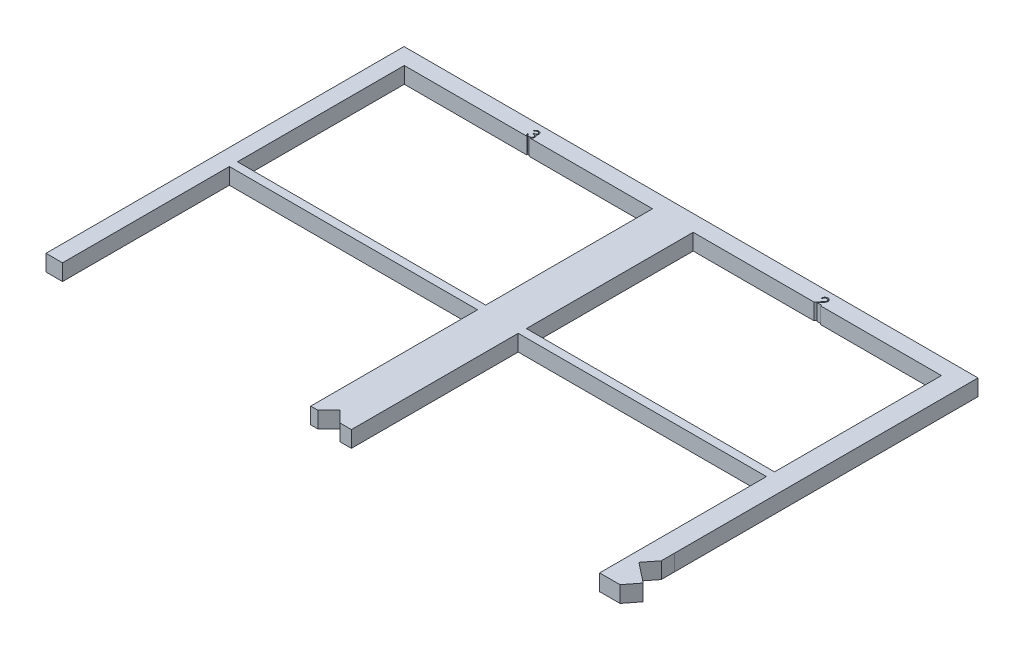
from build123d import *

# Parameters (mm, degrees)
SKETCH1_W           = 77.47
SKETCH1_H           = 52.07
BOSS_EXTRUDE4_DEPTH = 5.08
CUT_EXTRUDE9_DEPTH  = 5.08
CUT_EXTRUDE10_DEPTH = 5.08


with BuildPart() as part:
    # Sketch1 → Boss-Extrude4 (new body)
    with BuildSketch(Plane(origin=(0, 0, 0), x_dir=(1, 0, 0), z_dir=(0, 1, 0))):
        Polygon((-151.207591036, -110.49), (-146.05, -110.49), (-146.05, -58.42), (-68.58, -58.42), (-68.58, -110.49), (-55.88, -110.49), (-55.88, -58.42), (21.59, -58.42), (21.59, -110.49), (34.29, -110.49), (34.29, -58.42), (111.76, -58.42), (111.76, -110.49), (151.052408964, -110.49), (151.052408964, 110.49), (-151.207591036, 110.49), align=None)
        with Locations((-107.315, -29.845)):
            Rectangle(SKETCH1_W, SKETCH1_H, mode=Mode.SUBTRACT)
        with Locations((-17.145, -29.845)):
            Rectangle(SKETCH1_W, SKETCH1_H, mode=Mode.SUBTRACT)
        with Locations((73.025, -29.845)):
            Rectangle(SKETCH1_W, SKETCH1_H, mode=Mode.SUBTRACT)
        with Locations((-107.315, 24.765)):
            Rectangle(SKETCH1_W, SKETCH1_H, mode=Mode.SUBTRACT)
        with Locations((-17.145, 24.765)):
            Rectangle(SKETCH1_W, SKETCH1_H, mode=Mode.SUBTRACT)
        with Locations((-107.315, 79.375)):
            Rectangle(SKETCH1_W, SKETCH1_H, mode=Mode.SUBTRACT)
        with Locations((-17.145, 79.375)):
            Rectangle(SKETCH1_W, SKETCH1_H, mode=Mode.SUBTRACT)
        with Locations((73.025, 24.765)):
            Rectangle(SKETCH1_W, SKETCH1_H, mode=Mode.SUBTRACT)
        with Locations((73.025, 79.375)):
            Rectangle(SKETCH1_W, SKETCH1_H, mode=Mode.SUBTRACT)
    extrude(amount=BOSS_EXTRUDE4_DEPTH)

    # Sketch8 → Cut-Extrude9 (cut)
    # profile 1 of 7: a face of its own
    with BuildSketch(Plane(origin=(0, 5.08, 0), x_dir=(1, 0, 0), z_dir=(0, 1, 0))):
        Polygon((118.11, 79.293589744), (111.76, 76.362820513), (111.76, 76.982301683), (113.79525641, 77.921063702), (113.79525641, 80.799679487), (111.76, 81.765154247), (111.76, 82.387179487), (118.11, 79.375), align=None)
        Polygon((116.872309696, 79.340655048), (114.446538462, 80.49057492), (114.446538462, 78.221264022), align=None, mode=Mode.SUBTRACT)
    # profile 2 of 7: a face of its own
    with BuildSketch(Plane(origin=(0, 5.08, 0), x_dir=(1, 0, 0), z_dir=(0, 1, 0))):
        with BuildLine():
            Line((118.11, 26.474615385), (118.11, 25.235653045))
            add(Edge.make_bspline(
                [(118.11, 25.235653045), (118.109681139, 25.175004234), (118.109063106, 25.057451746), (118.099477996, 24.886510758), (118.086408481, 24.726402202), (118.065671027, 24.577079644), (118.040648803, 24.438612083), (118.010346937, 24.310582227), (117.974012938, 24.193397201), (117.916234684, 24.053492664), (117.830376936, 23.893979465), (117.703506539, 23.721262382), (117.548326213, 23.573571833), (117.37327911, 23.4462338), (117.180718496, 23.344994626), (116.975233967, 23.271753187), (116.75947595, 23.225383899), (116.611351899, 23.220615168), (116.536492388, 23.218205128)],
                knots=[0, 0, 0, 0, 1.001505555, 1.941167018, 2.826882275, 3.653841531, 4.429895133, 5.150066043, 5.825578002, 6.45369114, 7.647487171, 8.808567382, 9.977351308, 11.170798116, 12.373658725, 13.556498008, 14.765093433, 16, 16, 16, 16], degree=3))
            add(Edge.make_bspline(
                [(116.536492388, 23.218205128), (116.466353726, 23.220150205), (116.328524642, 23.223972465), (116.12725909, 23.261767034), (115.934882118, 23.318037757), (115.753765338, 23.399726219), (115.586236491, 23.504802861), (115.433291194, 23.631250472), (115.29863595, 23.781802882), (115.223670167, 23.894781468), (115.185590946, 23.952169471)],
                knots=[0, 0, 0, 0, 1.044266239, 2.052081639, 3.041743201, 4.026043445, 5.00270663, 5.980942822, 6.97441044, 8, 8, 8, 8], degree=3))
            add(Edge.make_bspline(
                [(115.185590946, 23.952169471), (115.157917248, 23.880020614), (115.10497061, 23.741981978), (115.010852235, 23.551885993), (114.90963819, 23.387448746), (114.798522364, 23.248489243), (114.677253559, 23.131437365), (114.548260115, 23.026322349), (114.405191505, 22.938259533), (114.252121508, 22.862606152), (114.090124446, 22.803067733), (113.919941192, 22.760940396), (113.743474705, 22.735055197), (113.623194862, 22.731525492), (113.562473958, 22.72974359)],
                knots=[0, 0, 0, 0, 1.272302504, 2.434229863, 3.488457646, 4.447234501, 5.35599188, 6.26022912, 7.18267843, 8.11661068, 9.06895546, 10.019249207, 11.000057067, 12, 12, 12, 12], degree=3))
            add(Edge.make_bspline(
                [(113.562473958, 22.72974359), (113.500485842, 22.731516424), (113.378522486, 22.735004524), (113.199347436, 22.7607231), (113.028142769, 22.804311677), (112.863691196, 22.864204763), (112.70692357, 22.942816916), (112.555876508, 23.036423505), (112.414573802, 23.150354586), (112.279655118, 23.277346904), (112.158418428, 23.421179366), (112.05048411, 23.576340817), (111.961311987, 23.745062992), (111.887341532, 23.924729456), (111.830014808, 24.116534097), (111.790215937, 24.31976575), (111.763336967, 24.53446858), (111.761131196, 24.681807332), (111.76, 24.757367788)],
                knots=[0, 0, 0, 0, 0.978404568, 1.925038397, 2.85041836, 3.763147166, 4.682162379, 5.614488577, 6.562659439, 7.54271123, 8.535210642, 9.526693784, 10.520907202, 11.541451354, 12.589717429, 13.675358278, 14.807842563, 16, 16, 16, 16], degree=3))
            Line((111.76, 24.757367788), (111.76, 26.474615385))
            Line((111.76, 26.474615385), (118.11, 26.474615385))
        make_face()
        with BuildLine():
            Line((117.458717949, 25.90474359), (115.423461538, 25.90474359))
            Line((115.423461538, 25.90474359), (115.423461538, 25.521860978))
            add(Edge.make_bspline(
                [(115.423461538, 25.521860978), (115.424181075, 25.465891945), (115.425571367, 25.357748368), (115.429679415, 25.200723225), (115.440678409, 25.055331233), (115.452311659, 24.921071395), (115.470224485, 24.798843581), (115.49214475, 24.688238604), (115.515124768, 24.588262886), (115.554315522, 24.473021329), (115.611648095, 24.342338932), (115.702715767, 24.203911992), (115.808237502, 24.079896012), (115.932241327, 23.976344233), (116.067626032, 23.890895914), (116.214403686, 23.833871415), (116.366844139, 23.793424687), (116.471770578, 23.789877771), (116.525044071, 23.788076923)],
                knots=[0, 0, 0, 0, 1.156481963, 2.23455883, 3.244418989, 4.168404366, 5.01828131, 5.794834307, 6.498111525, 7.13526334, 8.307595709, 9.435046769, 10.546766856, 11.659452936, 12.760769924, 13.837671619, 14.902137667, 16, 16, 16, 16], degree=3))
            add(Edge.make_bspline(
                [(116.525044071, 23.788076923), (116.56030457, 23.788977603), (116.629471889, 23.790744385), (116.729913527, 23.8068242), (116.82558773, 23.830156168), (116.914294057, 23.866607821), (116.998553798, 23.910685404), (117.074624411, 23.96802234), (117.1466735, 24.032775181), (117.212055599, 24.108821091), (117.270638216, 24.195791849), (117.322185781, 24.294516129), (117.362847974, 24.406172748), (117.399324126, 24.528230019), (117.4246346, 24.66264136), (117.445797527, 24.808093389), (117.456555228, 24.965820019), (117.457980962, 25.074940101), (117.458717949, 25.131346154)],
                knots=[0, 0, 0, 0, 0.911752476, 1.788502045, 2.626783689, 3.45400582, 4.26402138, 5.080402872, 5.911472738, 6.767166405, 7.66795952, 8.620018292, 9.640966946, 10.73819047, 11.913090943, 13.176185384, 14.540321519, 16, 16, 16, 16], degree=3))
            Line((117.458717949, 25.131346154), (117.458717949, 25.90474359))
        make_face(mode=Mode.SUBTRACT)
        with BuildLine():
            Line((114.772179487, 25.90474359), (112.411282051, 25.90474359))
            Line((112.411282051, 25.90474359), (112.411282051, 25.093185096))
            add(Edge.make_bspline(
                [(112.411282051, 25.093185096), (112.411975847, 25.035093328), (112.413313047, 24.923129104), (112.417726104, 24.761477849), (112.427553327, 24.612056238), (112.443574322, 24.47477829), (112.460221531, 24.348435585), (112.483262073, 24.23428334), (112.509456384, 24.132146551), (112.549993321, 24.013731405), (112.612860676, 23.880302727), (112.708268617, 23.736613475), (112.820435778, 23.607586425), (112.95189156, 23.499274679), (113.093745082, 23.409835086), (113.245254404, 23.347105881), (113.401797428, 23.306771901), (113.508807295, 23.302005692), (113.562473958, 23.299615385)],
                knots=[0, 0, 0, 0, 1.159821618, 2.235403267, 3.228114831, 4.14795534, 4.994323282, 5.771256229, 6.471395042, 7.097801288, 8.267864287, 9.404187171, 10.531774336, 11.667624178, 12.792825787, 13.866573821, 14.930062559, 16, 16, 16, 16], degree=3))
            add(Edge.make_bspline(
                [(113.562473958, 23.299615385), (113.596030503, 23.300103956), (113.662602321, 23.301073218), (113.760357737, 23.31624054), (113.855472736, 23.337399943), (113.946509043, 23.368040578), (114.034948011, 23.406675936), (114.119249173, 23.455161844), (114.2014282, 23.511153881), (114.305201688, 23.598743929), (114.42480707, 23.726024945), (114.541892162, 23.906931894), (114.636322991, 24.112618706), (114.676417579, 24.261803289), (114.697129407, 24.338868189)],
                knots=[0, 0, 0, 0, 0.723503378, 1.435336582, 2.130201219, 2.824764462, 3.504949994, 4.209866579, 4.920640069, 5.648298893, 7.13757748, 8.670694625, 10.280166878, 12, 12, 12, 12], degree=3))
            add(Edge.make_bspline(
                [(114.697129407, 24.338868189), (114.703398338, 24.369763806), (114.716990673, 24.436751875), (114.731329404, 24.545986183), (114.744191712, 24.671110852), (114.753456167, 24.811591078), (114.763401398, 24.967985569), (114.767131466, 25.140244081), (114.771684212, 25.328488394), (114.772010172, 25.459103286), (114.772179487, 25.526949119)],
                knots=[0, 0, 0, 0, 0.634452549, 1.375623993, 2.216454381, 3.166361212, 4.209414599, 5.370755378, 6.634280627, 8, 8, 8, 8], degree=3))
            Line((114.772179487, 25.526949119), (114.772179487, 25.90474359))
        make_face(mode=Mode.SUBTRACT)
    # profile 3 of 7: a face of its own
    with BuildSketch(Plane(origin=(0, 5.08, 0), x_dir=(1, 0, 0), z_dir=(0, 1, 0))):
        with BuildLine():
            Line((116.944815705, -32.938589744), (116.563205128, -32.439951923))
            add(Edge.make_bspline(
                [(116.563205128, -32.439951923), (116.605597673, -32.40438124), (116.689811221, -32.333719444), (116.808065537, -32.220037748), (116.918855368, -32.10156191), (117.022708493, -31.978337218), (117.115993196, -31.848145673), (117.203570769, -31.714141081), (117.282070808, -31.574081771), (117.377253654, -31.380403623), (117.476578821, -31.127042527), (117.559860398, -30.808100462), (117.612875959, -30.475158898), (117.618617886, -30.248014681), (117.621538462, -30.132479968)],
                knots=[0, 0, 0, 0, 0.757959112, 1.505699292, 2.245454638, 2.979532153, 3.711538275, 4.438200793, 5.171680507, 5.909471876, 7.393775596, 8.890124382, 10.418191784, 12, 12, 12, 12], degree=3))
            add(Edge.make_bspline(
                [(117.621538462, -30.132479968), (117.620802251, -30.068829613), (117.619336663, -29.942119638), (117.600137483, -29.754060275), (117.572842033, -29.56915638), (117.533326202, -29.388095544), (117.481880175, -29.211237272), (117.421547717, -29.037234935), (117.346470096, -28.868137816), (117.263556886, -28.701910874), (117.169880198, -28.542661658), (117.067735433, -28.391952614), (116.958125128, -28.250472259), (116.84133222, -28.117828549), (116.715905207, -27.995476207), (116.58331959, -27.881454356), (116.441979536, -27.777817938), (116.294535759, -27.682020268), (116.140771545, -27.596777475), (115.9816542, -27.523166197), (115.817792087, -27.46007521), (115.648849522, -27.409690045), (115.475491338, -27.369948117), (115.297349628, -27.342492588), (115.114770175, -27.323466123), (114.991019157, -27.322014016), (114.928639824, -27.321282051)],
                knots=[0, 0, 0, 0, 1.055000685, 2.100209969, 3.131349012, 4.153242145, 5.170189196, 6.184191144, 7.204341339, 8.235672124, 9.263040994, 10.265373269, 11.252624173, 12.22887325, 13.193405896, 14.155809299, 15.126090485, 16.097288279, 17.069732292, 18.038585918, 19.002221264, 19.978698174, 20.959418239, 21.948869816, 22.966084182, 24, 24, 24, 24], degree=3))
            add(Edge.make_bspline(
                [(114.928639824, -27.321282051), (114.834784429, -27.323571352), (114.650511811, -27.328066089), (114.380599417, -27.368068066), (114.122026195, -27.428855875), (113.876408481, -27.519961279), (113.640717603, -27.632300128), (113.418941397, -27.774250951), (113.207728487, -27.938655241), (113.012070568, -28.12783883), (112.833338524, -28.335403668), (112.675948183, -28.55810345), (112.544748325, -28.795383515), (112.435571964, -29.044623973), (112.351649044, -29.307742779), (112.29256842, -29.584266778), (112.254029036, -29.873594541), (112.250339344, -30.071296166), (112.248461538, -30.171913061)],
                knots=[0, 0, 0, 0, 1.029171465, 2.020641659, 2.987623507, 3.938342917, 4.889210282, 5.84687017, 6.821220943, 7.821438502, 8.827599549, 9.822697543, 10.807740252, 11.797342354, 12.80366471, 13.83203677, 14.896651826, 16, 16, 16, 16], degree=3))
            add(Edge.make_bspline(
                [(112.248461538, -30.171913061), (112.251525467, -30.282770797), (112.257556013, -30.50096534), (112.308644936, -30.820947331), (112.391481444, -31.127263648), (112.507410532, -31.41993077), (112.658114697, -31.698123628), (112.840809417, -31.962277569), (113.057232535, -32.212615561), (113.222483354, -32.363149173), (113.306794872, -32.439951923)],
                knots=[0, 0, 0, 0, 1.028121516, 2.023589091, 2.998037872, 3.967518031, 4.937445131, 5.927275754, 6.942489185, 8, 8, 8, 8], degree=3))
            Line((113.306794872, -32.439951923), (112.929000401, -32.938589744))
            add(Edge.make_bspline(
                [(112.929000401, -32.938589744), (112.877223407, -32.898461226), (112.773917427, -32.818396404), (112.628282924, -32.688750355), (112.491292127, -32.552178781), (112.36407883, -32.407649584), (112.243987323, -32.256891333), (112.135043577, -32.097248498), (112.033928993, -31.93147842), (111.942568033, -31.758615962), (111.860652906, -31.579228654), (111.791497891, -31.393503181), (111.731069307, -31.20301302), (111.681684053, -31.007662239), (111.643076564, -30.806798224), (111.617282312, -30.601110145), (111.599606535, -30.390163816), (111.597995761, -30.247848605), (111.597179487, -30.175729167)],
                knots=[0, 0, 0, 0, 0.986756325, 1.968786143, 2.935506311, 3.899499537, 4.868307269, 5.8376204, 6.809456583, 7.792545619, 8.781780509, 9.778496008, 10.776623214, 11.79151764, 12.812666265, 13.856269958, 14.913646641, 16, 16, 16, 16], degree=3))
            add(Edge.make_bspline(
                [(111.597179487, -30.175729167), (111.597654817, -30.107432799), (111.598594721, -29.97238519), (111.613820511, -29.772997455), (111.634593605, -29.578887787), (111.665872129, -29.390610966), (111.702782574, -29.207139554), (111.752260425, -29.030136779), (111.807685342, -28.857860898), (111.872827246, -28.691004051), (111.946335178, -28.52942431), (112.029414149, -28.373642823), (112.121365532, -28.223731239), (112.220162479, -28.07821569), (112.328978441, -27.939245788), (112.446302192, -27.805617249), (112.571738298, -27.676580756), (112.662189246, -27.596747314), (112.707666266, -27.556608574)],
                knots=[0, 0, 0, 0, 1.114604814, 2.203992996, 3.262667896, 4.300477797, 5.318619304, 6.316056647, 7.298880507, 8.271930387, 9.238335007, 10.195173496, 11.151986948, 12.108099108, 13.064862484, 14.031167946, 15.010108607, 16, 16, 16, 16], degree=3))
            add(Edge.make_bspline(
                [(112.707666266, -27.556608574), (112.786662423, -27.492318192), (112.943701026, -27.364513598), (113.198219878, -27.200999858), (113.463955057, -27.061032151), (113.742302642, -26.947864409), (114.032638045, -26.859394879), (114.335107621, -26.798106139), (114.649428887, -26.758279657), (114.86321849, -26.753725276), (114.971889022, -26.751410256)],
                knots=[0, 0, 0, 0, 0.994628077, 1.977248131, 2.950237994, 3.925870899, 4.908910175, 5.911660606, 6.938484602, 8, 8, 8, 8], degree=3))
            add(Edge.make_bspline(
                [(114.971889022, -26.751410256), (115.086103424, -26.754244442), (115.310813128, -26.759820525), (115.640671219, -26.806804203), (115.956243845, -26.883302707), (116.258745252, -26.988641657), (116.546444643, -27.127611896), (116.820557094, -27.295846609), (117.080858784, -27.494989044), (117.324021732, -27.72253816), (117.546337205, -27.97213776), (117.741930009, -28.239412742), (117.904702809, -28.523860895), (118.040767384, -28.82234304), (118.145350881, -29.137095699), (118.218563099, -29.467446937), (118.264132722, -29.812776116), (118.269893457, -30.048383659), (118.272820513, -30.168096955)],
                knots=[0, 0, 0, 0, 1.032901378, 2.032168977, 3.007206631, 3.966850309, 4.924221947, 5.891988639, 6.871730993, 7.884084801, 8.900290346, 9.89161143, 10.874607481, 11.860025555, 12.854717796, 13.869097222, 14.917278314, 16, 16, 16, 16], degree=3))
            add(Edge.make_bspline(
                [(118.272820513, -30.168096955), (118.27194643, -30.24105764), (118.270216271, -30.385475968), (118.253322795, -30.599110851), (118.225211517, -30.807112405), (118.186697164, -31.009983654), (118.139491479, -31.208460249), (118.077695589, -31.40050597), (118.005935411, -31.587166578), (117.925394904, -31.768581871), (117.833318651, -31.942778105), (117.733314188, -32.109723579), (117.623073079, -32.267404402), (117.506239897, -32.418786561), (117.378444314, -32.560461963), (117.243848093, -32.696476823), (117.098457292, -32.822132675), (116.996123317, -32.89969966), (116.944815705, -32.938589744)],
                knots=[0, 0, 0, 0, 1.096705196, 2.170817488, 3.219277236, 4.250701065, 5.274195539, 6.284202015, 7.28098643, 8.279664616, 9.266225751, 10.241373748, 11.203306326, 12.157093976, 13.114198862, 14.069774147, 15.032234603, 16, 16, 16, 16], degree=3))
        make_face()
    # profile 4 of 7: a face of its own
    with BuildSketch(Plane(origin=(0, 5.08, 0), x_dir=(1, 0, 0), z_dir=(0, 1, 0))):
        with BuildLine():
            Line((111.76, -82.012692308), (118.11, -82.012692308))
            Line((118.11, -82.012692308), (118.11, -83.294903846))
            add(Edge.make_bspline(
                [(118.11, -83.294903846), (118.10919924, -83.406426385), (118.107652175, -83.62188735), (118.097786915, -83.933238257), (118.080511466, -84.220906485), (118.054862343, -84.484728674), (118.024076207, -84.725128674), (117.984923928, -84.941721457), (117.938878197, -85.134858028), (117.899605318, -85.253638066), (117.881033654, -85.309807692)],
                knots=[0, 0, 0, 0, 1.314317071, 2.539253741, 3.67075822, 4.709970291, 5.662644612, 6.526156501, 7.303037452, 8, 8, 8, 8], degree=3))
            add(Edge.make_bspline(
                [(117.881033654, -85.309807692), (117.853037914, -85.383276673), (117.797681284, -85.528548601), (117.693258165, -85.735390771), (117.574941266, -85.930107124), (117.44258475, -86.11375686), (117.2924032, -86.282089414), (117.130916153, -86.441891296), (116.951524797, -86.585988874), (116.760320009, -86.720164865), (116.555362101, -86.837571052), (116.340810785, -86.941109671), (116.117067511, -87.029513574), (115.882503759, -87.098492965), (115.639371325, -87.15548169), (115.385829701, -87.193719768), (115.123356971, -87.219119775), (114.945238152, -87.221659883), (114.854861779, -87.222948718)],
                knots=[0, 0, 0, 0, 0.98467389, 1.947018643, 2.898343565, 3.837828625, 4.779009928, 5.722093987, 6.681368302, 7.658573986, 8.646467994, 9.637429229, 10.641859304, 11.657149908, 12.698561448, 13.768651538, 14.867827761, 16, 16, 16, 16], degree=3))
            add(Edge.make_bspline(
                [(114.854861779, -87.222948718), (114.776373797, -87.221806822), (114.621705032, -87.219556598), (114.39375275, -87.199375846), (114.172580583, -87.169987158), (113.959159893, -87.124695693), (113.752052982, -87.069043404), (113.552243376, -87.000351318), (113.359584615, -86.918944546), (113.175646042, -86.82449634), (113.000731948, -86.721221421), (112.837852299, -86.607986514), (112.683909336, -86.491289421), (112.545846691, -86.362132049), (112.415768103, -86.229414775), (112.300701958, -86.08609986), (112.195636064, -85.936856417), (112.101337325, -85.778809783), (112.019522725, -85.608171823), (111.94943361, -85.422613554), (111.891722261, -85.221141181), (111.843495333, -85.004063511), (111.805260876, -84.770955192), (111.779629867, -84.521602395), (111.762298604, -84.256383924), (111.760781079, -84.074267288), (111.76, -83.980530849)],
                knots=[0, 0, 0, 0, 1.105818345, 2.179130549, 3.222742436, 4.24813173, 5.251184997, 6.243232575, 7.223185975, 8.195898781, 9.155064964, 10.083206407, 10.990357329, 11.874224667, 12.744762365, 13.607037788, 14.46074101, 15.315384698, 16.197310979, 17.123950979, 18.107232398, 19.148086642, 20.256146639, 21.433991621, 22.679261309, 24, 24, 24, 24], degree=3))
            Line((111.76, -83.980530849), (111.76, -82.012692308))
        make_face()
        with BuildLine():
            Line((112.411282051, -82.582564103), (112.411282051, -83.311440304))
            add(Edge.make_bspline(
                [(112.411282051, -83.311440304), (112.411732169, -83.416176063), (112.41259791, -83.617621283), (112.420194693, -83.907286506), (112.432607922, -84.171953411), (112.449979849, -84.411659579), (112.472964337, -84.626269665), (112.498590946, -84.816232183), (112.53051775, -84.980924438), (112.559457347, -85.08058213), (112.572830529, -85.126634615)],
                knots=[0, 0, 0, 0, 1.375205317, 2.645023457, 3.804390687, 4.853969522, 5.800190428, 6.637939096, 7.370582563, 8, 8, 8, 8], degree=3))
            add(Edge.make_bspline(
                [(112.572830529, -85.126634615), (112.593242549, -85.184599298), (112.633579048, -85.299144178), (112.707184232, -85.464010709), (112.794265109, -85.61784952), (112.891632722, -85.763227177), (113.000795015, -85.899202305), (113.122082386, -86.02517169), (113.254153497, -86.142030641), (113.397503093, -86.248500834), (113.551204387, -86.34363756), (113.713300631, -86.426559757), (113.883400607, -86.496918019), (114.062117399, -86.554129451), (114.249282549, -86.598465023), (114.444403664, -86.63000926), (114.647541614, -86.649619319), (114.785702691, -86.651909464), (114.856133814, -86.653076923)],
                knots=[0, 0, 0, 0, 0.998463025, 1.973077781, 2.929496817, 3.867873318, 4.813809365, 5.759268434, 6.706333209, 7.676553387, 8.657505312, 9.640584699, 10.632319813, 11.645628493, 12.686877747, 13.755137172, 14.855624085, 16, 16, 16, 16], degree=3))
            add(Edge.make_bspline(
                [(114.856133814, -86.653076923), (114.930398398, -86.652144681), (115.07629183, -86.650313282), (115.290366967, -86.627332533), (115.49623045, -86.593678155), (115.694030492, -86.545268959), (115.88350975, -86.482728451), (116.065738702, -86.407893664), (116.238372234, -86.317032486), (116.402872487, -86.214168026), (116.556748208, -86.098683831), (116.698196661, -85.971092184), (116.827481331, -85.832738462), (116.94480806, -85.684260293), (117.048090353, -85.523581703), (117.139968669, -85.353421689), (117.218033951, -85.17138332), (117.259539698, -85.044720759), (117.280633013, -84.980350561)],
                knots=[0, 0, 0, 0, 1.122272916, 2.204715076, 3.251197285, 4.274229216, 5.279697671, 6.265416158, 7.248880903, 8.225321784, 9.195852973, 10.153576302, 11.101466393, 12.055578741, 13.010401466, 13.985536859, 14.976245305, 16, 16, 16, 16], degree=3))
            add(Edge.make_bspline(
                [(117.280633013, -84.980350561), (117.295358532, -84.927099195), (117.326669026, -84.813872182), (117.36082363, -84.629106297), (117.390948936, -84.421161669), (117.416454236, -84.189115068), (117.434755519, -83.933231006), (117.448492047, -83.653312687), (117.457756937, -83.349239119), (117.458389591, -83.138450807), (117.458717949, -83.029048478)],
                knots=[0, 0, 0, 0, 0.674548936, 1.434276114, 2.292660221, 3.240891867, 4.284742987, 5.42552168, 6.663806718, 8, 8, 8, 8], degree=3))
            Line((117.458717949, -83.029048478), (117.458717949, -82.582564103))
            Line((117.458717949, -82.582564103), (112.411282051, -82.582564103))
        make_face(mode=Mode.SUBTRACT)
    # profile 5 of 7: a face of its own
    with BuildSketch(Plane(origin=(0, 5.08, 0), x_dir=(1, 0, 0), z_dir=(0, 1, 0))):
        with BuildLine():
            Line((-108.006987179, 107.852307692), (-108.291923077, 107.852307692))
            add(Edge.make_bspline(
                [(-108.291923077, 107.852307692), (-108.284203699, 107.884268588), (-108.269112946, 107.946749526), (-108.23763729, 108.03601897), (-108.203347966, 108.120495307), (-108.162173564, 108.198596746), (-108.117262051, 108.271892893), (-108.065806439, 108.338721313), (-108.010180691, 108.400781646), (-107.948653773, 108.455857226), (-107.884129915, 108.50572988), (-107.815699939, 108.548252254), (-107.7447406, 108.584832021), (-107.670760258, 108.614967517), (-107.593538659, 108.637669242), (-107.513773929, 108.654140059), (-107.43125704, 108.664836284), (-107.375243154, 108.66588019), (-107.346800881, 108.666410256)],
                knots=[0, 0, 0, 0, 1.162005537, 2.271625781, 3.343758855, 4.383309926, 5.390229558, 6.379919256, 7.361854164, 8.333198761, 9.295911338, 10.242430842, 11.177959212, 12.116337295, 13.062827104, 14.020064771, 14.994644689, 16, 16, 16, 16], degree=3))
            add(Edge.make_bspline(
                [(-107.346800881, 108.666410256), (-107.305360108, 108.665159098), (-107.223382505, 108.662684071), (-107.102947456, 108.640083118), (-106.986808841, 108.604318891), (-106.876237881, 108.554903438), (-106.773532588, 108.493954947), (-106.682150476, 108.421415507), (-106.603330184, 108.338684712), (-106.53720457, 108.247305886), (-106.485429392, 108.14964696), (-106.447251039, 108.049135389), (-106.424008514, 107.9460096), (-106.420996295, 107.876379783), (-106.419487179, 107.841495393)],
                knots=[0, 0, 0, 0, 1.083050992, 2.142477498, 3.193116406, 4.255571735, 5.30263384, 6.308962982, 7.297363603, 8.282367274, 9.249857812, 10.179914175, 11.08814088, 12, 12, 12, 12], degree=3))
            add(Edge.make_bspline(
                [(-106.419487179, 107.841495393), (-106.420542723, 107.807924943), (-106.422608257, 107.742232783), (-106.44014669, 107.646328282), (-106.469661729, 107.555939116), (-106.510546442, 107.470684776), (-106.563470562, 107.391105814), (-106.627580795, 107.317023185), (-106.703329638, 107.248108306), (-106.760732674, 107.208629927), (-106.790285457, 107.188305288)],
                knots=[0, 0, 0, 0, 1.024540389, 2.004866551, 2.965041327, 3.920577974, 4.882998113, 5.874504559, 6.905732034, 8, 8, 8, 8], degree=3))
            add(Edge.make_bspline(
                [(-106.790285457, 107.188305288), (-106.756510937, 107.171996519), (-106.689593843, 107.139684128), (-106.598380149, 107.076314977), (-106.515578076, 107.003148148), (-106.469401131, 106.94605017), (-106.44619992, 106.917361779)],
                knots=[0, 0, 0, 0, 1.015518401, 2.012035669, 3.001164323, 4, 4, 4, 4], degree=3))
            add(Edge.make_bspline(
                [(-106.44619992, 106.917361779), (-106.430922416, 106.896445104), (-106.400617589, 106.85495428), (-106.363211069, 106.788246236), (-106.329275659, 106.720798814), (-106.302832245, 106.65080421), (-106.282354523, 106.57907369), (-106.267716837, 106.505484088), (-106.258623509, 106.429975311), (-106.257321258, 106.378891847), (-106.256666667, 106.353214143)],
                knots=[0, 0, 0, 0, 1.025084078, 2.033381695, 3.024893161, 4.013698104, 4.991890475, 5.976764909, 6.982997093, 8, 8, 8, 8], degree=3))
            add(Edge.make_bspline(
                [(-106.256666667, 106.353214143), (-106.258294547, 106.308755324), (-106.261542646, 106.220046911), (-106.290574914, 106.088987699), (-106.335581211, 105.960875994), (-106.399495717, 105.838343818), (-106.477389814, 105.723698758), (-106.570061101, 105.621122392), (-106.676456629, 105.532949372), (-106.795116039, 105.459280094), (-106.923673719, 105.400390265), (-107.061174435, 105.359516727), (-107.205636984, 105.332895713), (-107.304703604, 105.330041054), (-107.355069111, 105.328589744)],
                knots=[0, 0, 0, 0, 0.955779014, 1.907060117, 2.875433937, 3.871313158, 4.872415639, 5.851225146, 6.836215519, 7.83643374, 8.849228613, 9.86973379, 10.916971861, 12, 12, 12, 12], degree=3))
            add(Edge.make_bspline(
                [(-107.355069111, 105.328589744), (-107.389013762, 105.329377337), (-107.455805515, 105.330927058), (-107.553997832, 105.341521218), (-107.647725373, 105.36087058), (-107.737114866, 105.386908578), (-107.82224572, 105.419921087), (-107.902858158, 105.46103162), (-107.979448133, 105.509392769), (-108.051292896, 105.565575381), (-108.118383883, 105.628423453), (-108.17893814, 105.699052698), (-108.233965237, 105.776157486), (-108.281991774, 105.860633401), (-108.325205295, 105.951388741), (-108.36074802, 106.049585593), (-108.392031357, 106.154346099), (-108.406576, 106.227350906), (-108.414038462, 106.264807692)],
                knots=[0, 0, 0, 0, 1.048658725, 2.063410685, 3.046034179, 4.001477787, 4.936774919, 5.862367409, 6.792675028, 7.730719943, 8.675894397, 9.627829632, 10.600096036, 11.597688215, 12.626045268, 13.701542398, 14.82072376, 16, 16, 16, 16], degree=3))
            Line((-108.414038462, 106.264807692), (-108.129102564, 106.264807692))
            add(Edge.make_bspline(
                [(-108.129102564, 106.264807692), (-108.12167915, 106.240361087), (-108.107239964, 106.192810317), (-108.082661565, 106.124375183), (-108.054659633, 106.061638949), (-108.024619997, 106.004141403), (-107.993070978, 105.951316295), (-107.957769582, 105.904560456), (-107.921330429, 105.861820237), (-107.89386273, 105.837740482), (-107.880419671, 105.825955529)],
                knots=[0, 0, 0, 0, 1.198163088, 2.33053128, 3.407730985, 4.417276592, 5.372219308, 6.28897303, 7.162600585, 8, 8, 8, 8], degree=3))
            add(Edge.make_bspline(
                [(-107.880419671, 105.825955529), (-107.862642777, 105.812250112), (-107.827143861, 105.784881583), (-107.769296966, 105.749955106), (-107.708459534, 105.71969189), (-107.643313365, 105.696574537), (-107.575264252, 105.677000516), (-107.503212285, 105.664191188), (-107.427793138, 105.655402633), (-107.376296667, 105.654627088), (-107.34998097, 105.654230769)],
                knots=[0, 0, 0, 0, 0.946170439, 1.889420265, 2.845303464, 3.807233317, 4.801018734, 5.828864929, 6.890507805, 8, 8, 8, 8], degree=3))
            add(Edge.make_bspline(
                [(-107.34998097, 105.654230769), (-107.320268864, 105.654789483), (-107.262169405, 105.655882), (-107.177392497, 105.665929249), (-107.096740741, 105.680561838), (-107.021109587, 105.703161472), (-106.949508341, 105.731084102), (-106.882940702, 105.766143727), (-106.820532806, 105.807277867), (-106.763083988, 105.854031247), (-106.711426277, 105.905213603), (-106.665942576, 105.958746889), (-106.627275919, 106.014405392), (-106.596085101, 106.072497116), (-106.571455674, 106.132781502), (-106.55468877, 106.195427726), (-106.54303061, 106.259923103), (-106.542081183, 106.303764382), (-106.541602564, 106.325865385)],
                knots=[0, 0, 0, 0, 1.217147791, 2.380027433, 3.494444702, 4.572153297, 5.609568379, 6.639424714, 7.649109417, 8.668170816, 9.669597737, 10.625200337, 11.543417969, 12.441394052, 13.322311151, 14.205496177, 15.095365482, 16, 16, 16, 16], degree=3))
            add(Edge.make_bspline(
                [(-106.541602564, 106.325865385), (-106.542990766, 106.355448528), (-106.545760263, 106.414467612), (-106.566904474, 106.501297126), (-106.601683301, 106.584956936), (-106.650371936, 106.664019688), (-106.709640776, 106.737294971), (-106.778914656, 106.802674101), (-106.858768834, 106.856621969), (-106.93226543, 106.893895251), (-106.997366679, 106.919328883), (-107.053079206, 106.936269744), (-107.115451268, 106.950614988), (-107.183728599, 106.96396112), (-107.258425659, 106.975319772), (-107.339461128, 106.984791991), (-107.426851426, 106.992371206), (-107.487349841, 106.995755843), (-107.518525641, 106.9975)],
                knots=[0, 0, 0, 0, 1.07054697, 2.135767047, 3.216561865, 4.33974944, 5.486079747, 6.621378074, 7.775625952, 8.963672916, 9.598146892, 10.304877434, 11.070270905, 11.915000392, 12.823868403, 13.805723172, 14.86925407, 16, 16, 16, 16], degree=3))
            Line((-107.518525641, 106.9975), (-107.518525641, 107.323141026))
            add(Edge.make_bspline(
                [(-107.518525641, 107.323141026), (-107.479245298, 107.323807598), (-107.402304755, 107.325113248), (-107.289914921, 107.340904801), (-107.182442702, 107.36274937), (-107.082269872, 107.396209509), (-106.990967111, 107.435071778), (-106.911755757, 107.480294854), (-106.84574556, 107.530563948), (-106.793257302, 107.586654958), (-106.753770073, 107.64681218), (-106.724898621, 107.709510862), (-106.707844039, 107.775300546), (-106.705567413, 107.82019928), (-106.704423077, 107.842767428)],
                knots=[0, 0, 0, 0, 1.321986639, 2.589447074, 3.816329219, 5.01088745, 6.139805852, 7.153945165, 8.075214402, 8.924034688, 9.728124013, 10.488707548, 11.240355623, 12, 12, 12, 12], degree=3))
            add(Edge.make_bspline(
                [(-106.704423077, 107.842767428), (-106.704799007, 107.859347954), (-106.705546902, 107.892334124), (-106.714978718, 107.94052615), (-106.729151955, 107.987244866), (-106.748637138, 108.032291594), (-106.774717676, 108.075353913), (-106.80592882, 108.116798956), (-106.84309274, 108.156390099), (-106.885678967, 108.19329296), (-106.931409676, 108.228462197), (-106.981529114, 108.258319567), (-107.034526101, 108.283851159), (-107.090459309, 108.304905493), (-107.149510255, 108.320743562), (-107.211401489, 108.332115361), (-107.27625103, 108.339225234), (-107.320493959, 108.340248868), (-107.342984776, 108.340769231)],
                knots=[0, 0, 0, 0, 0.884392785, 1.759457502, 2.611959086, 3.489218968, 4.37281399, 5.2945488, 6.255912374, 7.266815255, 8.301784654, 9.332968512, 10.37626691, 11.440494194, 12.520033166, 13.637162961, 14.798855837, 16, 16, 16, 16], degree=3))
            add(Edge.make_bspline(
                [(-107.342984776, 108.340769231), (-107.379135932, 108.339507067), (-107.449747547, 108.337041767), (-107.551542508, 108.315449033), (-107.646175046, 108.280997486), (-107.718509408, 108.239873961), (-107.771924315, 108.199278925), (-107.810094109, 108.163825617), (-107.847577715, 108.124425841), (-107.88190915, 108.078652887), (-107.916629115, 108.029606584), (-107.94823811, 107.974793673), (-107.978953688, 107.915643972), (-107.997461715, 107.873828647), (-108.006987179, 107.852307692)],
                knots=[0, 0, 0, 0, 1.472543308, 2.876219568, 4.221790263, 5.565193594, 6.249813518, 6.953379497, 7.687249741, 8.463570142, 9.283606569, 10.136032583, 11.040678096, 12, 12, 12, 12], degree=3))
        make_face()
    # profile 6 of 7: a face of its own
    with BuildSketch(Plane(origin=(0, 5.08, 0), x_dir=(1, 0, 0), z_dir=(0, 1, 0))):
        with BuildLine():
            Line((-17.836987179, 107.608076923), (-18.121923077, 107.608076923))
            add(Edge.make_bspline(
                [(-18.121923077, 107.608076923), (-18.120066017, 107.645878371), (-18.1164188, 107.720119409), (-18.099338852, 107.828363239), (-18.074899627, 107.931827235), (-18.040345237, 108.029680657), (-17.997431685, 108.122788718), (-17.945969446, 108.210781589), (-17.885015024, 108.293323596), (-17.81588463, 108.369649547), (-17.74080165, 108.4396697), (-17.659788405, 108.500135528), (-17.574657559, 108.551223701), (-17.48566739, 108.593933113), (-17.391813879, 108.625991402), (-17.293948715, 108.649778175), (-17.191641927, 108.664089574), (-17.12193705, 108.665627894), (-17.086486378, 108.666410256)],
                knots=[0, 0, 0, 0, 1.10065271, 2.161652631, 3.183658789, 4.190468796, 5.17591951, 6.163126047, 7.15150782, 8.156236427, 9.156009102, 10.134482811, 11.092018607, 12.041330605, 13.001268258, 13.972401359, 14.968799086, 16, 16, 16, 16], degree=3))
            add(Edge.make_bspline(
                [(-17.086486378, 108.666410256), (-17.051671982, 108.665595228), (-16.983262938, 108.663993726), (-16.883420968, 108.650240507), (-16.788372994, 108.628699863), (-16.698304806, 108.598478021), (-16.613935018, 108.557852148), (-16.534629828, 108.509050095), (-16.459445093, 108.452607819), (-16.391766082, 108.386156146), (-16.329619467, 108.315215411), (-16.276005278, 108.239479956), (-16.230091909, 108.161257675), (-16.191821656, 108.079952092), (-16.163649302, 107.994797659), (-16.142260499, 107.907034125), (-16.13017063, 107.815753047), (-16.128315139, 107.753970671), (-16.127371795, 107.722560096)],
                knots=[0, 0, 0, 0, 1.111607364, 2.184268762, 3.212621178, 4.221274766, 5.211760367, 6.196651075, 7.1921475, 8.207485113, 9.220403448, 10.201281604, 11.166441695, 12.114753415, 13.065576456, 14.026450734, 14.996634279, 16, 16, 16, 16], degree=3))
            add(Edge.make_bspline(
                [(-16.127371795, 107.722560096), (-16.128907826, 107.678338846), (-16.131952934, 107.590672367), (-16.158000975, 107.461844598), (-16.198683167, 107.337027711), (-16.247666484, 107.236573158), (-16.297080773, 107.155625632), (-16.341610154, 107.088979021), (-16.393738947, 107.01721906), (-16.45422587, 106.940586047), (-16.52181969, 106.858479726), (-16.597132653, 106.770949697), (-16.680701811, 106.678900306), (-16.739356308, 106.616030225), (-16.769749599, 106.583452524)],
                knots=[0, 0, 0, 0, 1.184426356, 2.348067706, 3.509069118, 4.696110526, 5.333549288, 6.050745305, 6.844228056, 7.710549037, 8.667450064, 9.695053472, 10.805634456, 12, 12, 12, 12], degree=3))
            Line((-16.769749599, 106.583452524), (-17.564135617, 105.735641026))
            Line((-17.564135617, 105.735641026), (-16.086666667, 105.735641026))
            Line((-16.086666667, 105.735641026), (-16.086666667, 105.41))
            Line((-16.086666667, 105.41), (-18.244038462, 105.41))
            Line((-18.244038462, 105.41), (-17.012708333, 106.72401242))
            add(Edge.make_bspline(
                [(-17.012708333, 106.72401242), (-16.982729179, 106.755307312), (-16.925145359, 106.815418396), (-16.843699735, 106.903178081), (-16.770548653, 106.984593736), (-16.70521859, 107.059511533), (-16.649126767, 107.129027313), (-16.599349814, 107.190889651), (-16.559466742, 107.247816902), (-16.516182061, 107.313803031), (-16.474259378, 107.39436849), (-16.438234598, 107.492824051), (-16.416268271, 107.59417663), (-16.413633171, 107.662667764), (-16.412307692, 107.697119391)],
                knots=[0, 0, 0, 0, 1.329631726, 2.553950428, 3.673215718, 4.687767853, 5.603093632, 6.413772471, 7.123043292, 7.734684054, 8.834405432, 9.900288307, 10.943827018, 12, 12, 12, 12], degree=3))
            add(Edge.make_bspline(
                [(-16.412307692, 107.697119391), (-16.412884401, 107.718783231), (-16.414020984, 107.7614785), (-16.424051896, 107.824076581), (-16.439210712, 107.884460376), (-16.460932482, 107.942815624), (-16.48960431, 107.998555608), (-16.524505162, 108.051748179), (-16.564773291, 108.103173169), (-16.611356228, 108.151390804), (-16.662529535, 108.195551612), (-16.716590033, 108.234671318), (-16.773785485, 108.26736394), (-16.833874739, 108.294164112), (-16.896690271, 108.315187494), (-16.962353576, 108.329754919), (-17.030683219, 108.338901173), (-17.077340748, 108.340138671), (-17.101114784, 108.340769231)],
                knots=[0, 0, 0, 0, 0.991446411, 1.95395049, 2.89581595, 3.838931463, 4.798493298, 5.75982156, 6.748411868, 7.785213223, 8.824556874, 9.840280684, 10.836137867, 11.835679398, 12.848801643, 13.863922112, 14.911575587, 16, 16, 16, 16], degree=3))
            add(Edge.make_bspline(
                [(-17.101114784, 108.340769231), (-17.125944039, 108.340120594), (-17.174704597, 108.33884678), (-17.246295434, 108.32993622), (-17.314590389, 108.314563922), (-17.379761259, 108.293539367), (-17.441918311, 108.266816255), (-17.500759266, 108.233531601), (-17.556152029, 108.193813718), (-17.608200733, 108.148782642), (-17.656155914, 108.098647032), (-17.698289865, 108.042757994), (-17.735105364, 107.982135982), (-17.767226597, 107.916944568), (-17.793312116, 107.846592211), (-17.813244903, 107.77132865), (-17.829017256, 107.691480682), (-17.834286414, 107.636339927), (-17.836987179, 107.608076923)],
                knots=[0, 0, 0, 0, 1.031018746, 2.02475058, 2.990194455, 3.934040569, 4.864654155, 5.795059489, 6.735614925, 7.690564532, 8.649604399, 9.611025574, 10.590972636, 11.591080095, 12.624614302, 13.701020113, 14.821632451, 16, 16, 16, 16], degree=3))
        make_face()
    # profile 7 of 7: a face of its own
    with BuildSketch(Plane(origin=(0, 5.08, 0), x_dir=(1, 0, 0), z_dir=(0, 1, 0))):
        Polygon((72.600776242, 108.585), (73.187820513, 108.585), (73.187820513, 105.41), (72.902884615, 105.41), (72.902884615, 108.259358974), (72.414423077, 108.259358974), align=None)
    extrude(amount=-CUT_EXTRUDE9_DEPTH, mode=Mode.SUBTRACT)


with BuildPart() as cut_extrude9_piece_1:
    # of the separate pieces the step leaves, piece 1, a body of its own (cut_extrude9_pieces)
    add(part.part.solids().sort_by_distance((151.052408964, 0, -110.49))[0])


with BuildPart() as cut_extrude9_piece_2:
    # of the separate pieces the step leaves, piece 2, a body of its own (cut_extrude9_pieces)
    add(part.part.solids().sort_by_distance((117.458717949, 0, 82.582564103))[0])


with BuildPart() as cut_extrude9_piece_3:
    # of the separate pieces the step leaves, piece 3, a body of its own (cut_extrude9_pieces)
    add(part.part.solids().sort_by_distance((111.76, 0, -81.765154247))[0])


with BuildPart() as cut_extrude9_piece_4:
    # of the separate pieces the step leaves, piece 4, a body of its own (cut_extrude9_pieces)
    add(part.part.solids().sort_by_distance((114.772179487, 0, -25.526949119))[0])


with BuildPart() as cut_extrude9_piece_5:
    # of the separate pieces the step leaves, piece 5, a body of its own (cut_extrude9_pieces)
    add(part.part.solids().sort_by_distance((117.458717949, 0, -25.131346154))[0])


with BuildPart() as cut_extrude9_piece_6:
    # of the separate pieces the step leaves, piece 6, a body of its own (cut_extrude9_pieces)
    add(part.part.solids().sort_by_distance((114.446538462, 0, -78.221264022))[0])


with BuildPart() as cut_extrude10_tool:
    # Sketch9 → Cut-Extrude10 (new body)
    with BuildSketch(Plane(origin=(0, 5.08, 0), x_dir=(1, 0, 0), z_dir=(0, 1, 0))):
        Polygon((151.052408964, -110.49), (151.052408964, 110.49), (27.94, 110.49), (27.94, 15.733069971), (27.944531833, 11.627344972), (24.86439919, 7.717295891), (31.124383857, 2.78600661), (27.958767714, -1.27), (-59.506834459, -1.27), (-62.934325445, 2.157490986), (-66.361816431, -1.27), (-151.207591036, -1.27), (-151.207591036, -110.49), align=None)
    extrude(amount=-CUT_EXTRUDE10_DEPTH)


with BuildPart() as cut_extrude9_piece_1_1:
    add(cut_extrude9_piece_1.part)

    # Cut-Extrude10: cut by cut_extrude10_tool
    add(cut_extrude10_tool.part, mode=Mode.SUBTRACT)


with BuildPart() as cut_extrude9_piece_2_1:
    add(cut_extrude9_piece_2.part)

    # Cut-Extrude10: cut by cut_extrude10_tool
    add(cut_extrude10_tool.part, mode=Mode.SUBTRACT)


with BuildPart() as cut_extrude9_piece_3_1:
    add(cut_extrude9_piece_3.part)

    # Cut-Extrude10: cut by cut_extrude10_tool
    add(cut_extrude10_tool.part, mode=Mode.SUBTRACT)


with BuildPart() as cut_extrude9_piece_4_1:
    add(cut_extrude9_piece_4.part)

    # Cut-Extrude10: cut by cut_extrude10_tool
    add(cut_extrude10_tool.part, mode=Mode.SUBTRACT)


with BuildPart() as cut_extrude9_piece_5_1:
    add(cut_extrude9_piece_5.part)

    # Cut-Extrude10: cut by cut_extrude10_tool
    add(cut_extrude10_tool.part, mode=Mode.SUBTRACT)


with BuildPart() as cut_extrude9_piece_6_1:
    add(cut_extrude9_piece_6.part)

    # Cut-Extrude10: cut by cut_extrude10_tool
    add(cut_extrude10_tool.part, mode=Mode.SUBTRACT)


solid = cut_extrude9_piece_1_1.part
